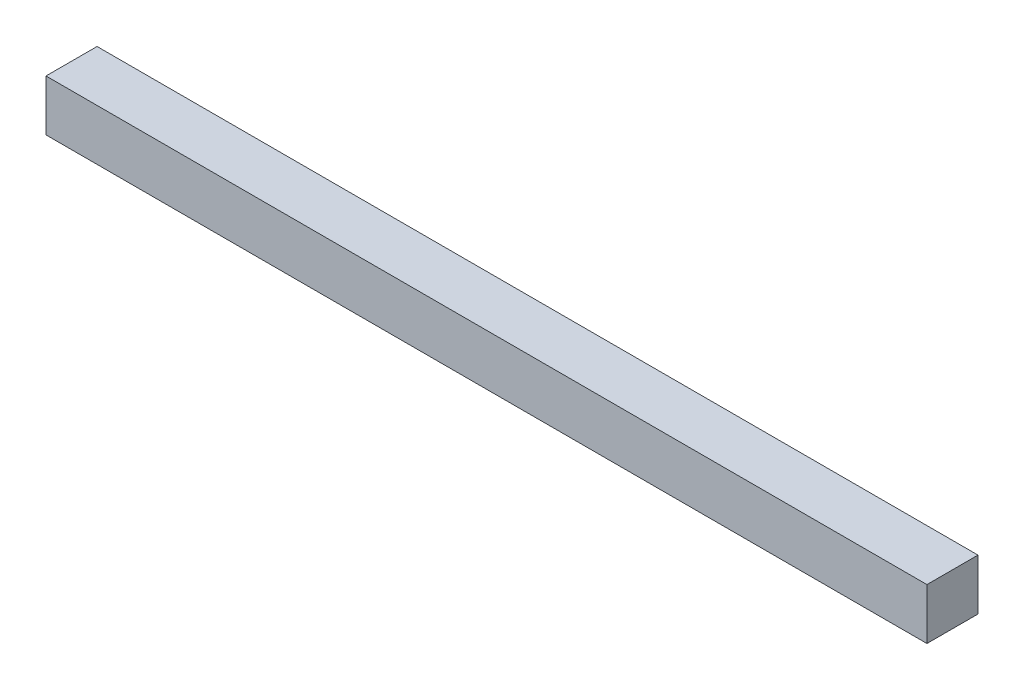
from build123d import *

# Parameters (mm, degrees)
SKETCH1_W           = 40
SKETCH1_H           = 40
BOSS_EXTRUDE1_DEPTH = 690


with BuildPart() as part:
    # Sketch1 → Boss-Extrude1 (new body)
    with BuildSketch(Plane(origin=(0, 0, 0), x_dir=(0, 0, -1), z_dir=(1, 0, 0))):
        Rectangle(SKETCH1_W, SKETCH1_H)
    extrude(amount=BOSS_EXTRUDE1_DEPTH)


solid = part.part
